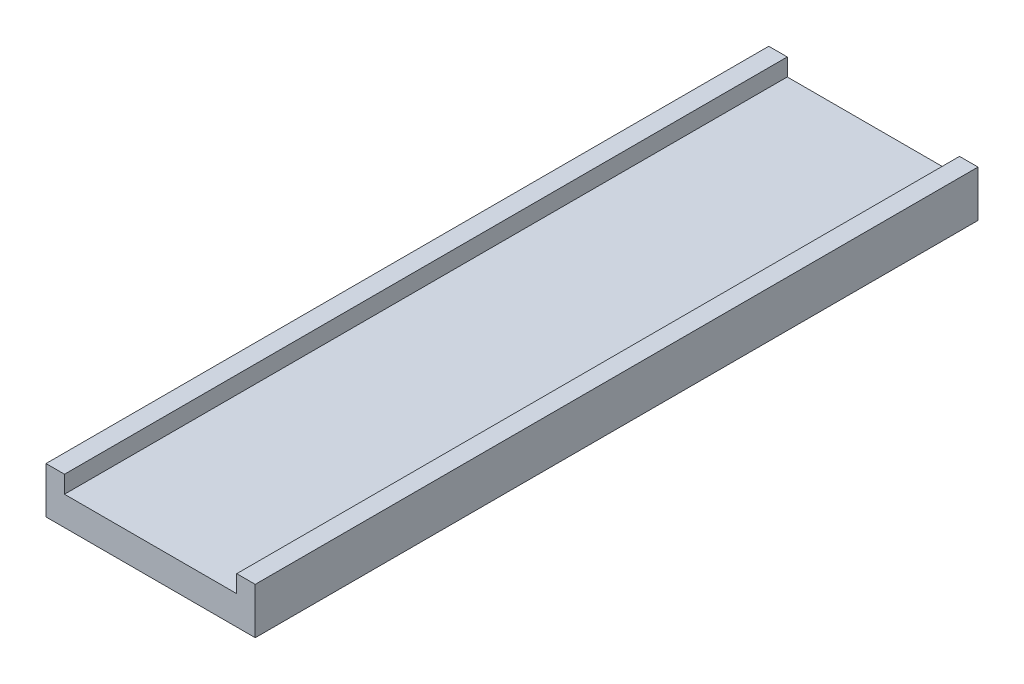
from build123d import *

# Parameters (mm, degrees)
EXTRUDE_1_DEPTH = 250


with BuildPart() as part:
    # Эскиз1 → Бобышка-Вытянуть1 (new body)
    with BuildSketch(Plane.XY):
        Polygon((-36.186125013, 0), (36.186125013, 0), (36.186125013, 16), (29.788761687, 16), (29.788761687, 10), (-29.788761687, 10), (-29.788761687, 16), (-36.186125013, 16), align=None)
    extrude(amount=EXTRUDE_1_DEPTH)


solid = part.part
